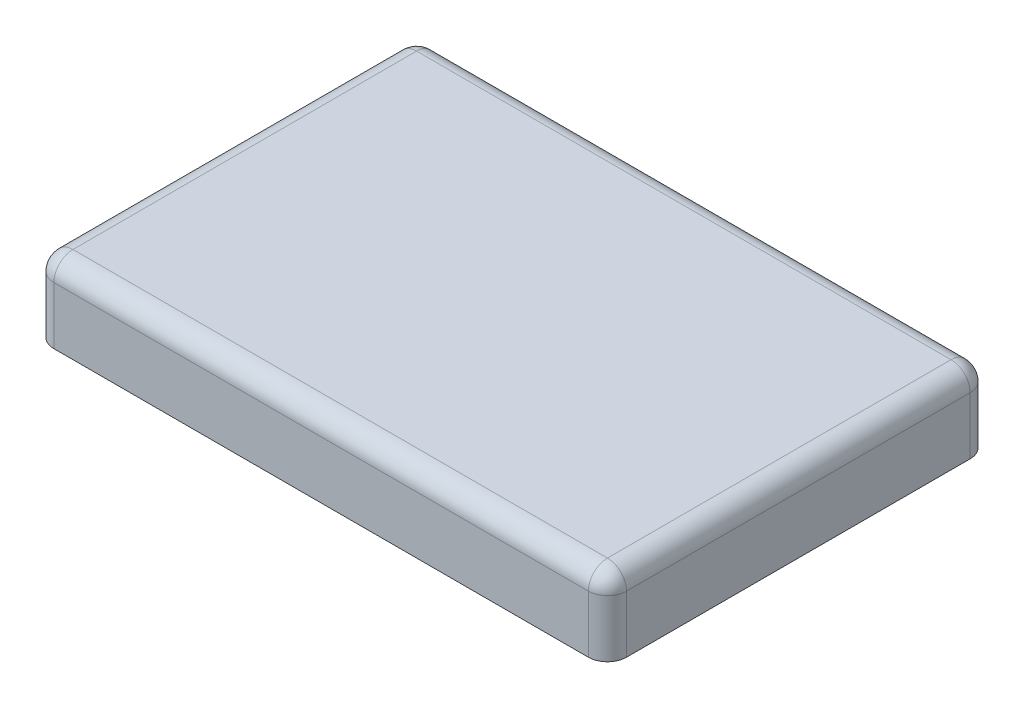
from build123d import *

# Parameters (mm, degrees)
SKETCH1_W           = 190.5
SKETCH1_H           = 127
BOSS_EXTRUDE1_DEPTH = 25.4
FILLET1_R           = 6.35
SHELL1_T            = -2.54


with BuildPart() as part:
    # Sketch1 → Boss-Extrude1 (new body)
    with BuildSketch(Plane(origin=(0, 0, 0), x_dir=(1, 0, 0), z_dir=(0, 1, 0))):
        Rectangle(SKETCH1_W, SKETCH1_H)
    extrude(amount=BOSS_EXTRUDE1_DEPTH)

    # Fillet1
    fillet1_edges = [part.edges().sort_by_distance(p)[0] for p in [
        (-95.25, 25.4, 0),
        (0, 25.4, 63.5),
        (95.25, 25.4, 0),
        (0, 25.4, -63.5),
        (95.25, 12.7, 63.5),
        (-95.25, 12.7, 63.5),
        (-95.25, 12.7, -63.5),
        (95.25, 12.7, -63.5),
    ]]
    fillet(fillet1_edges, radius=FILLET1_R)

    # Shell1
    shell1_openings = [part.faces().sort_by_distance(p)[0] for p in [
        (0, 0, 0),
    ]]
    offset(amount=SHELL1_T, openings=shell1_openings, kind=Kind.INTERSECTION)


solid = part.part
